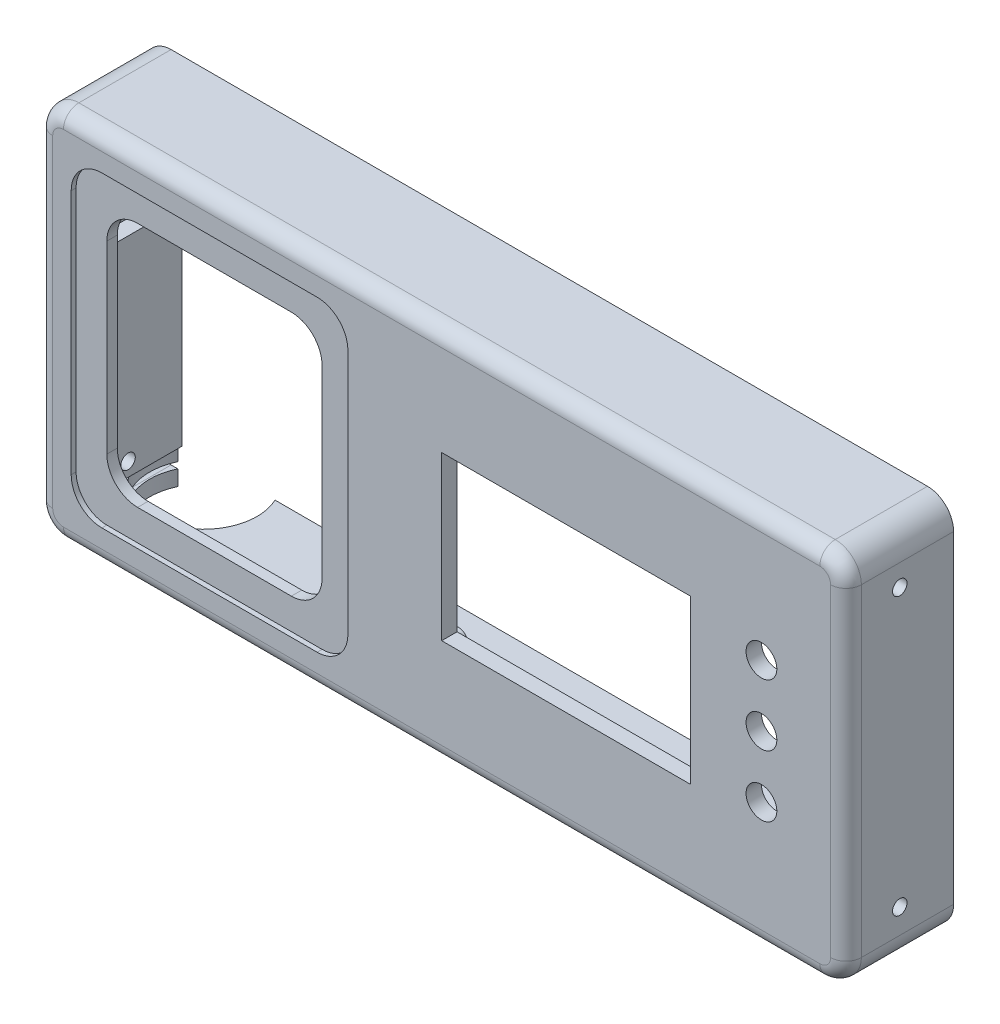
from build123d import *

# Parameters (mm, degrees)
SKETCH1_W             = 263
SKETCH1_H             = 122
SKETCH1_W_2           = 253
SKETCH1_H_2           = 112
BOSS_EXTRUDE1_DEPTH   = 30
SKETCH1_W_3           = 249
SKETCH1_H_3           = 108
SKETCH1_W_4           = 239
SKETCH1_H_4           = 98
BOSS_EXTRUDE1_2_DEPTH = 30
SKETCH2_W             = 263
SKETCH2_H             = 122
BOSS_EXTRUDE2_DEPTH   = 5
FILLET1_R             = 1.5
SKETCH3_R             = 17.5
CUT_EXTRUDE1_DEPTH    = 12
FILLET2_R             = 3.5
FILLET3_R             = 8.5
FILLET4_R             = 5
SKETCH4_R             = 2.35
CUT_EXTRUDE2_DEPTH    = 279
SKETCH5_W             = 20
SKETCH5_H             = 35
CUT_EXTRUDE3_DEPTH    = 30
SKETCH6_W             = 7.5
SKETCH6_H             = 9
SKETCH6_W_2           = 22.5
CUT_EXTRUDE4_DEPTH    = 2.5
SKETCH7_R             = 5
CUT_EXTRUDE8_DEPTH    = 73.5
SKETCH9_R             = 3
SKETCH9_R_2           = 1.25
BOSS_EXTRUDE4_DEPTH   = 4
SKETCH10_W            = 81
SKETCH10_H            = 53
CUT_EXTRUDE9_DEPTH    = 13.6
SKETCH11_W            = 90
SKETCH11_H            = 100
CUT_EXTRUDE10_DEPTH   = 1.6
SKETCH12_W            = 70
SKETCH12_H            = 80
CUT_EXTRUDE11_DEPTH   = 11.6
FILLET5_R             = 10


with BuildPart() as part:
    # Sketch1 → Boss-Extrude1 (new body)
    with BuildSketch(Plane.XY):
        Rectangle(SKETCH1_W, SKETCH1_H)
        Rectangle(SKETCH1_W_2, SKETCH1_H_2, mode=Mode.SUBTRACT)
    extrude(amount=BOSS_EXTRUDE1_DEPTH)



with BuildPart() as body_2:
    # Sketch1 → Boss-Extrude1 2 (new body)
    with BuildSketch(Plane.XY):
        Rectangle(SKETCH1_W_3, SKETCH1_H_3)
        Rectangle(SKETCH1_W_4, SKETCH1_H_4, mode=Mode.SUBTRACT)
    extrude(amount=BOSS_EXTRUDE1_2_DEPTH)


with BuildPart() as part_1:
    add(part.part)

    add(body_2.part)  # Boss-Extrude2 merges body 2
    # Sketch2 → Boss-Extrude2 (add)
    with BuildSketch(Plane.XY.offset(30)):
        Rectangle(SKETCH2_W, SKETCH2_H)
    extrude(amount=BOSS_EXTRUDE2_DEPTH)

    # Fillet1
    fillet1_edges = [part_1.edges().sort_by_distance(p)[0] for p in [
        (-124.5, -54, 15),
        (124.5, -54, 15),
        (124.5, 54, 15),
        (-124.5, 54, 15),
    ]]
    fillet(fillet1_edges, radius=FILLET1_R)

    # Sketch3 → Cut-Extrude1 (cut)
    with BuildSketch(Plane(origin=(0, -61, 0), x_dir=(-1, 0, 0), z_dir=(0, -1, 0))):
        with Locations((105, -7.5)):
            Circle(SKETCH3_R)
        with Locations((-105, -7.5)):
            Circle(SKETCH3_R)
    extrude(amount=-CUT_EXTRUDE1_DEPTH, mode=Mode.SUBTRACT)

    # Fillet2
    fillet2_edges = [part_1.edges().sort_by_distance(p)[0] for p in [
        (126.5, 56, 15),
        (-126.5, 56, 15),
        (-126.5, -56, 15),
        (126.5, -56, 15),
    ]]
    fillet(fillet2_edges, radius=FILLET2_R)

    # Fillet3
    fillet3_edges = [part_1.edges().sort_by_distance(p)[0] for p in [
        (-131.5, -61, 17.5),
        (-131.5, 61, 17.5),
        (131.5, 61, 17.5),
        (131.5, -61, 17.5),
    ]]
    fillet(fillet3_edges, radius=FILLET3_R)

    # Fillet4
    fillet4_edges = [part_1.edges().sort_by_distance(p)[0] for p in [
        (0, -61, 35),
        (-131.5, 0, 35),
        (131.5, 0, 35),
        (0, 61, 35),
        (-129.01040764, 58.51040764, 35),
        (129.01040764, 58.51040764, 35),
        (129.01040764, -58.51040764, 35),
        (-129.01040764, -58.51040764, 35),
    ]]
    fillet(fillet4_edges, radius=FILLET4_R)

    # Sketch4 → Cut-Extrude2 (cut)
    with BuildSketch(Plane(origin=(131.5, 0, 0), x_dir=(0, 0, -1), z_dir=(1, 0, 0))):
        with Locations(Location((-17.5, -44.5, 0), (0, 0, 90))):
            Circle(SKETCH4_R)
        with Locations(Location((-17.5, 45.5, 0), (0, 0, 90))):
            Circle(SKETCH4_R)
    extrude(amount=-CUT_EXTRUDE2_DEPTH, mode=Mode.SUBTRACT)

    # Sketch5 → Cut-Extrude3 (cut)
    with BuildSketch(Plane(origin=(0, 0, 0), x_dir=(-1, 0, 0), z_dir=(0, 0, -1))):
        with Locations((114.5, 36.5)):
            Rectangle(SKETCH5_W, SKETCH5_H)
        with Locations((-114.5, 36.5)):
            Rectangle(SKETCH5_W, SKETCH5_H)
    extrude(amount=-CUT_EXTRUDE3_DEPTH, mode=Mode.SUBTRACT)

    # Sketch6 → Cut-Extrude4 (cut)
    with BuildSketch(Plane(origin=(-126.5, 0, 0), x_dir=(0, 0, -1), z_dir=(1, 0, 0))):
        with Locations((-3.75, 45.5)):
            Rectangle(SKETCH6_W, SKETCH6_H)
        with Locations((-11.25, 30.5)):
            Rectangle(SKETCH6_W_2, SKETCH6_H)
    extrude(amount=-CUT_EXTRUDE4_DEPTH, mode=Mode.SUBTRACT)

    # Sketch7 → Cut-Extrude8 (cut)
    with BuildSketch(Plane.XY.offset(30)):
        with Locations(Location((104, 20, 0), (0, 0, 180))):
            Circle(SKETCH7_R)
        with Locations(Location((104, 0, 0), (0, 0, 180))):
            Circle(SKETCH7_R)
        with Locations(Location((104, -20, 0), (0, 0, 180))):
            Circle(SKETCH7_R)
    extrude(amount=CUT_EXTRUDE8_DEPTH, mode=Mode.SUBTRACT)

    # Sketch9 → Boss-Extrude4 (add)
    # profile 1 of 4: a face of its own
    with BuildSketch(Plane(origin=(0, 0, 30), x_dir=(-1, 0, 0), z_dir=(0, 0, -1))):
        with Locations((-84.5, 32)):
            Circle(SKETCH9_R)
        with Locations((-84.5, 32)):
            Circle(SKETCH9_R_2, mode=Mode.SUBTRACT)
    # profile 2 of 4: a face of its own
    with BuildSketch(Plane(origin=(0, 0, 30), x_dir=(-1, 0, 0), z_dir=(0, 0, -1))):
        with Locations((-84.5, -32)):
            Circle(SKETCH9_R)
        with Locations((-84.5, -32)):
            Circle(SKETCH9_R_2, mode=Mode.SUBTRACT)
    # profile 3 of 4: a face of its own
    with BuildSketch(Plane(origin=(0, 0, 30), x_dir=(-1, 0, 0), z_dir=(0, 0, -1))):
        with Locations((3.5, -32)):
            Circle(SKETCH9_R)
        with Locations((3.5, -32)):
            Circle(SKETCH9_R_2, mode=Mode.SUBTRACT)
    # profile 4 of 4: a face of its own
    with BuildSketch(Plane(origin=(0, 0, 30), x_dir=(-1, 0, 0), z_dir=(0, 0, -1))):
        with Locations((3.5, 32)):
            Circle(SKETCH9_R)
        with Locations((3.5, 32)):
            Circle(SKETCH9_R_2, mode=Mode.SUBTRACT)
    extrude(amount=BOSS_EXTRUDE4_DEPTH)

    # Sketch10 → Cut-Extrude9 (cut)
    with BuildSketch(Plane(origin=(0, 0, 30), x_dir=(-1, 0, 0), z_dir=(0, 0, -1))):
        with Locations((-40.5, 0)):
            Rectangle(SKETCH10_W, SKETCH10_H)
    extrude(amount=-CUT_EXTRUDE9_DEPTH, mode=Mode.SUBTRACT)

    # Sketch11 → Cut-Extrude10 (cut)
    with BuildSketch(Plane.XY.offset(35)):
        with Locations((-75.5, 0)):
            Rectangle(SKETCH11_W, SKETCH11_H)
    extrude(amount=-CUT_EXTRUDE10_DEPTH, mode=Mode.SUBTRACT)

    # Sketch12 → Cut-Extrude11 (cut)
    with BuildSketch(Plane.XY.offset(33.4)):
        with Locations((-75.5, 0)):
            Rectangle(SKETCH12_W, SKETCH12_H)
    extrude(amount=-CUT_EXTRUDE11_DEPTH, mode=Mode.SUBTRACT)

    # Fillet5
    fillet5_edges = [part_1.edges().sort_by_distance(p)[0] for p in [
        (-30.5, 50, 34.2),
        (-30.5, -50, 34.2),
        (-120.5, -50, 34.2),
        (-120.5, 50, 34.2),
        (-110.5, -40, 31.7),
        (-110.5, 40, 31.7),
        (-40.5, 40, 31.7),
        (-40.5, -40, 31.7),
    ]]
    fillet(fillet5_edges, radius=FILLET5_R)


solid = part_1.part
